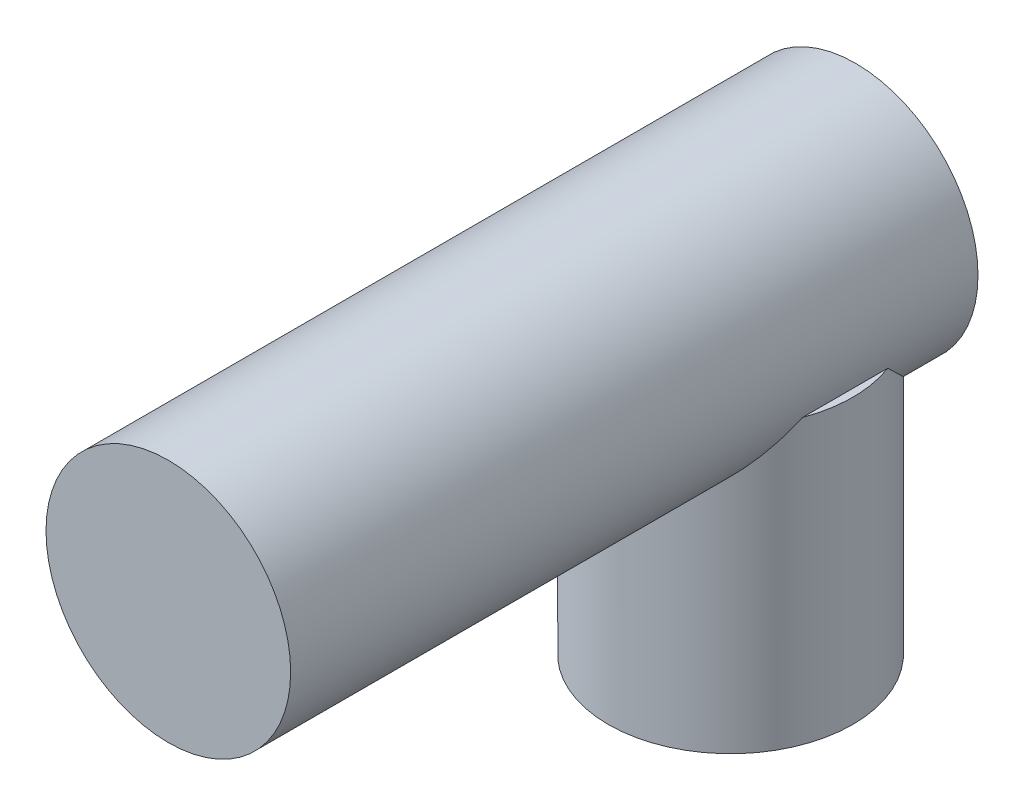
from build123d import *

# Parameters (mm, degrees)
SKETCH2_R                = 26.25
BOSS_EXTRUDE2_DEPTH      = 147.5
BOSS_EXTRUDE4_DEPTH      = 15.416
BOSS_EXTRUDE4_DEPTH_BACK = 45.4
SKETCH3_R                = 26.25


with BuildPart() as part:
    # Sketch2 → Boss-Extrude2 (new body)
    with BuildSketch(Plane.XY):
        with Locations((-32.979772941, 24.734829706)):
            Circle(SKETCH2_R)
    extrude(amount=BOSS_EXTRUDE2_DEPTH)

    # Sketch3 → Boss-Extrude4 (add, two sides: drawn at the far end of the back side and taken through both)
    with BuildSketch(Plane(origin=(0, 0, 0), x_dir=(1, 0, 0), z_dir=(0, 1, 0)).offset(-BOSS_EXTRUDE4_DEPTH_BACK)):
        with Locations(Location((-33.04352384, -26.794047718, 0), (0, 0, 270))):
            Circle(SKETCH3_R)
    extrude(amount=BOSS_EXTRUDE4_DEPTH + BOSS_EXTRUDE4_DEPTH_BACK)


solid = part.part
